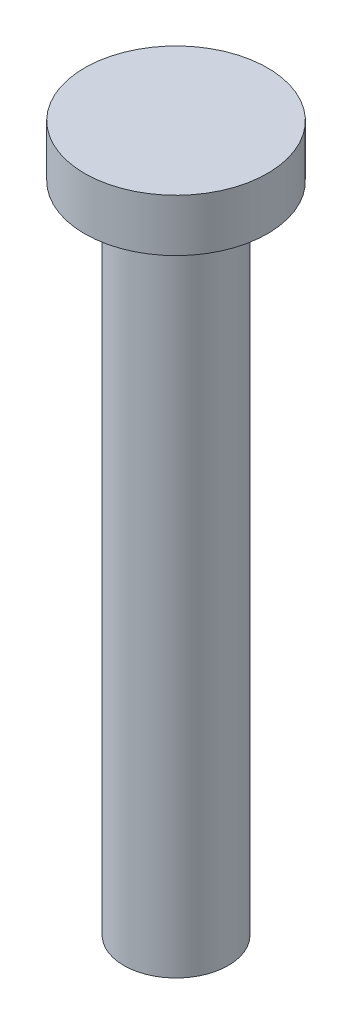
from build123d import *

# Parameters (mm, degrees)
ESQUISSE1_R      = 2
EXTRUSION1_DEPTH = 25
ESQUISSE2_R      = 3.5
EXTRUSION2_DEPTH = 2


with BuildPart() as part:
    # Esquisse1 → Extrusion1 (new body)
    with BuildSketch(Plane(origin=(0, 0, 0), x_dir=(1, 0, 0), z_dir=(0, 1, 0))):
        with Locations(Location((0, 0, 0), (0, 0, 270))):
            Circle(ESQUISSE1_R)
    extrude(amount=EXTRUSION1_DEPTH)

    # Esquisse2 → Extrusion2 (add)
    with BuildSketch(Plane(origin=(0, 25, 0), x_dir=(1, 0, 0), z_dir=(0, 1, 0))):
        with Locations(Location((0, 0, 0), (0, 0, 270))):
            Circle(ESQUISSE2_R)
    extrude(amount=EXTRUSION2_DEPTH)


solid = part.part
